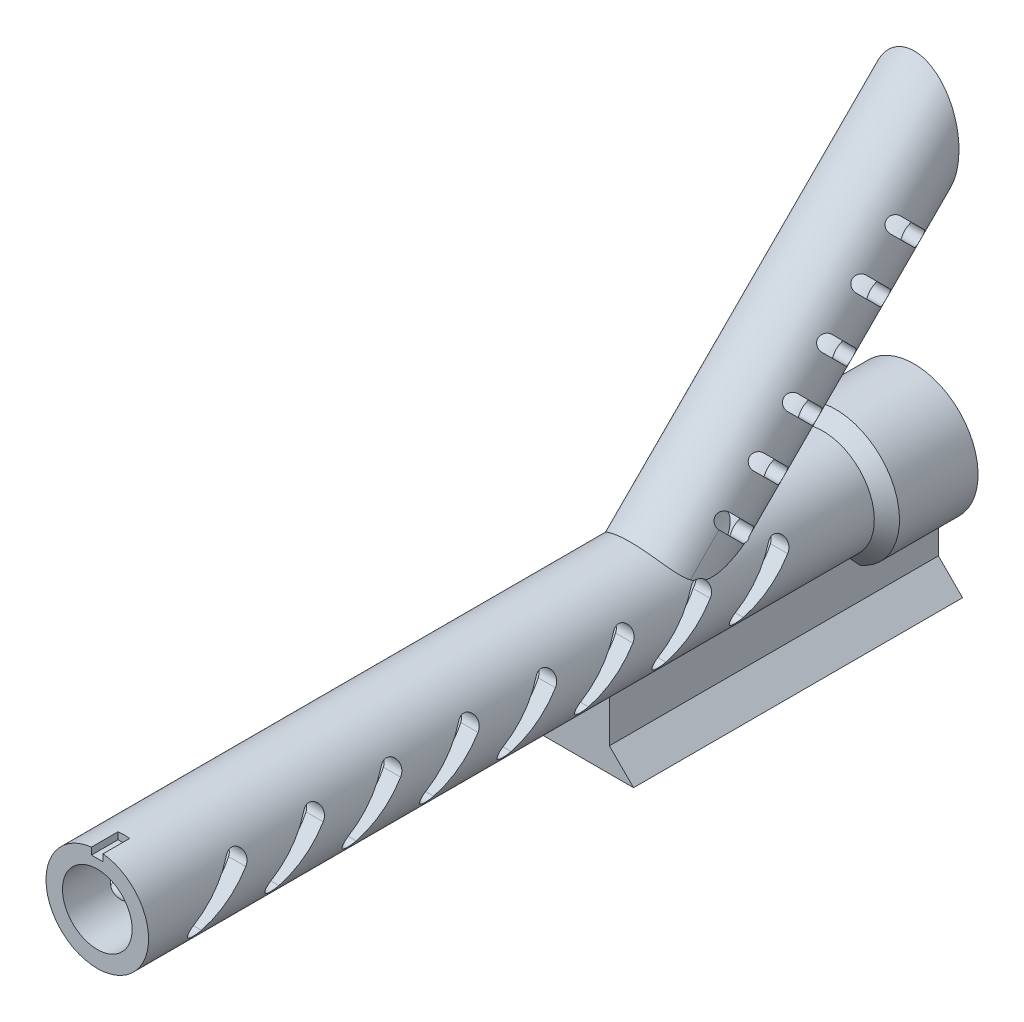
from build123d import *

# Parameters (mm, degrees)
BOSS_EXTRU_2_REACH                  = 163.916
BOSS_EXTRU_2_END_RADIUS             = 10.6
ESQUISSE12_R                        = 9.25
BOSS_EXTRU_2_DIRECTION_2_REACH      = 163.916
ENL_V_MAT_EXTRU_4_REACH             = 173.321
ENL_V_MAT_EXTRU_4_END_RADIUS        = 7.2
ESQUISSE16_R                        = 6.75
ENL_V_MAT_EXTRU_4_DIRECTION_2_REACH = 173.321
ENL_V_MAT_EXTRU_1_DEPTH             = 167.492403835
R_P_TITION_LIN_AIRE1_COUNT          = 8
R_P_TITION_LIN_AIRE1_PITCH          = 16
ESQUISSE5_W                         = 2.4
ESQUISSE5_H                         = 1.5
ENL_V_MAT_EXTRU_2_DEPTH             = 5.5
ENL_V_MAT_EXTRU_3_DEPTH             = 167.492403835
R_P_TITION_LIN_AIRE2_COUNT          = 6
R_P_TITION_LIN_AIRE2_PITCH          = 10
BOSS_EXTRU_3_DEPTH                  = 50
BOSS_EXTRU_3_DIRECTION_2_REACH      = 168.492
ESQUISSE17_W                        = 5.4
ESQUISSE17_H                        = 3.4
ENL_V_MAT_EXTRU_5_DEPTH             = 5


with BuildPart() as part:
    # Esquisse3 → Révolution2 (revolve)
    with BuildSketch(Plane(origin=(0, 0, 0), x_dir=(0, 0, -1), z_dir=(1, 0, 0)), mode=Mode.PRIVATE) as r_volution2_sk:
        Polygon((-0.842640687, 10.6), (-150.842640687, 10.6), (-150.842640687, 7.2), (0, 7.2), (3, 10.2), (18, 10.2), (18, 13.2), (1.757359313, 13.2), align=None)
    revolve(r_volution2_sk.sketch.rotate(Axis((0, 0, 115.245192858), (0, 0, -1)), 90), axis=Axis((0, 0, 115.245192858), (0, 0, -1)))

    # Boss.-Extru.2: up to this cylinder (the profile starts outside it)
    boss_extru_2_end = Plane(origin=(0, 0, 10.07132), z_dir=(0, 0, 1)) * Cylinder(BOSS_EXTRU_2_END_RADIUS, 350.032, mode=Mode.PRIVATE)
    # Esquisse12 → Boss.-Extru.2 (add, up to the surface)
    with BuildSketch(Plane(origin=(0, 9, -9), x_dir=(-1, 0, 0), z_dir=(0, 0.7071067811865475, -0.7071067811865477)), mode=Mode.PRIVATE) as boss_extru_2_sk1:
        with Locations(Location((0, 26.970919882, 0), (0, 0, 90))):
            Circle(ESQUISSE12_R)
    boss_extru_2_tool1 = extrude(boss_extru_2_sk1.sketch, amount=-BOSS_EXTRU_2_REACH, mode=Mode.PRIVATE) - boss_extru_2_end
    add(boss_extru_2_tool1.solids().sort_by_distance((0, 28.07132, 10.07132))[0])

    # Boss.-Extru.2 direction 2: up to this plane
    boss_extru_2_direction_2_end = Plane(origin=(0, 13.2, -18), z_dir=(0, 0, 1))
    # Esquisse12 → Boss.-Extru.2 direction 2 (add, up to the surface)
    with BuildSketch(Plane(origin=(0, 9, -9), x_dir=(-1, 0, 0), z_dir=(0, 0.7071067811865475, -0.7071067811865477)), mode=Mode.PRIVATE) as boss_extru_2_direction_2_sk1:
        with Locations(Location((0, 26.970919882, 0), (0, 0, 90))):
            Circle(ESQUISSE12_R)
    boss_extru_2_direction_2_tool1 = split(extrude(boss_extru_2_direction_2_sk1.sketch, amount=BOSS_EXTRU_2_DIRECTION_2_REACH, mode=Mode.PRIVATE), bisect_by=boss_extru_2_direction_2_end, keep=Keep.BOTH, mode=Mode.PRIVATE)
    add(boss_extru_2_direction_2_tool1.solids().sort_by_distance((0, 28.07132, 10.07132))[0])

    # Enlèv. mat.-Extru.4: up to this cylinder (the profile starts outside it)
    enl_v_mat_extru_4_end = Plane(origin=(0, 0, 10.07132), z_dir=(0, 0, 1)) * Cylinder(ENL_V_MAT_EXTRU_4_END_RADIUS, 362.042, mode=Mode.PRIVATE)
    # Esquisse16 → Enlèv. mat.-Extru.4 (cut, up to the surface)
    with BuildSketch(Plane(origin=(0, 9, -9), x_dir=(-1, 0, 0), z_dir=(0, 0.7071067811865475, -0.7071067811865477)), mode=Mode.PRIVATE) as enl_v_mat_extru_4_sk1:
        with Locations(Location((0, 26.970919882, 0), (0, 0, 270))):
            Circle(ESQUISSE16_R)
    enl_v_mat_extru_4_tool1 = extrude(enl_v_mat_extru_4_sk1.sketch, amount=-ENL_V_MAT_EXTRU_4_REACH, mode=Mode.PRIVATE) - enl_v_mat_extru_4_end
    add(enl_v_mat_extru_4_tool1.solids().sort_by_distance((0, 28.07132, 10.07132))[0], mode=Mode.SUBTRACT)

    # Enlèv. mat.-Extru.4 direction 2: up to this plane
    enl_v_mat_extru_4_direction_2_end = Plane(origin=(0, 13.2, -18), z_dir=(0, 0, 1))
    # Esquisse16 → Enlèv. mat.-Extru.4 direction 2 (cut, up to the surface)
    with BuildSketch(Plane(origin=(0, 9, -9), x_dir=(-1, 0, 0), z_dir=(0, 0.7071067811865475, -0.7071067811865477)), mode=Mode.PRIVATE) as enl_v_mat_extru_4_direction_2_sk1:
        with Locations(Location((0, 26.970919882, 0), (0, 0, 270))):
            Circle(ESQUISSE16_R)
    enl_v_mat_extru_4_direction_2_tool1 = split(extrude(enl_v_mat_extru_4_direction_2_sk1.sketch, amount=ENL_V_MAT_EXTRU_4_DIRECTION_2_REACH, mode=Mode.PRIVATE), bisect_by=enl_v_mat_extru_4_direction_2_end, keep=Keep.BOTH, mode=Mode.PRIVATE)
    add(enl_v_mat_extru_4_direction_2_tool1.solids().sort_by_distance((0, 28.07132, 10.07132))[0], mode=Mode.SUBTRACT)

    # Esquisse4 → Enlèv. mat.-Extru.1 (cut, symmetric)
    with BuildSketch(Plane(origin=(0, 0, 0), x_dir=(0, 0, -1), z_dir=(1, 0, 0))):
        with BuildLine():
            Line((-141.256854249, -2.585786438), (-133.256854249, 5.414213562))
            ThreePointArc((-133.256854249, 5.414213562), (-130.428427125, 5.414213562), (-130.428427125, 2.585786438))
            Line((-130.428427125, 2.585786438), (-138.428427125, -5.414213562))
            ThreePointArc((-138.428427125, -5.414213562), (-141.256854249, -5.414213562), (-141.256854249, -2.585786438))
        make_face()
    enl_v_mat_extru_1 = extrude(amount=ENL_V_MAT_EXTRU_1_DEPTH, both=True, mode=Mode.SUBTRACT)

    # Répétition linéaire1: Enlèv. mat.-Extru.1 ×8
    with Locations(*[(0, 0, -i * R_P_TITION_LIN_AIRE1_PITCH) for i in range(1, R_P_TITION_LIN_AIRE1_COUNT)]):
        add(enl_v_mat_extru_1, mode=Mode.SUBTRACT)

    # Esquisse5 → Enlèv. mat.-Extru.2 (cut)
    with BuildSketch(Plane.XY.offset(150.842640687)):
        with Locations((0, 9.85)):
            Rectangle(ESQUISSE5_W, ESQUISSE5_H)
    extrude(amount=-ENL_V_MAT_EXTRU_2_DEPTH, mode=Mode.SUBTRACT)

    # Esquisse13 → Enlèv. mat.-Extru.3 (cut, symmetric)
    with BuildSketch(Plane(origin=(0, 0, 0), x_dir=(0, 0, -1), z_dir=(1, 0, 0))):
        with BuildLine():
            Line((9.414213562, 42.607106781), (4.464466094, 47.556854249))
            ThreePointArc((4.464466094, 47.556854249), (4.464466094, 49.678174593), (6.585786438, 49.678174593))
            Line((6.585786438, 49.678174593), (11.535533906, 44.728427125))
            ThreePointArc((11.535533906, 44.728427125), (11.535533906, 42.607106781), (9.414213562, 42.607106781))
        make_face()
    enl_v_mat_extru_3 = extrude(amount=ENL_V_MAT_EXTRU_3_DEPTH, both=True, mode=Mode.SUBTRACT)

    # Répétition linéaire2: Enlèv. mat.-Extru.3 ×6
    with Locations(*[Vector(0, -0.7071067811865489, 0.7071067811865461) * (i * R_P_TITION_LIN_AIRE2_PITCH) for i in range(1, R_P_TITION_LIN_AIRE2_COUNT)]):
        add(enl_v_mat_extru_3, mode=Mode.SUBTRACT)

    # Esquisse14 → Boss.-Extru.3 (add)
    with BuildSketch(Plane(origin=(0, 0, 0), x_dir=(-1, 0, 0), z_dir=(0, 0, -1))):
        with BuildLine():
            Line((-5, -18.660254038), (-10, -23.660254038))
            Line((-10, -23.660254038), (10, -23.660254038))
            Line((10, -23.660254038), (5, -18.660254038))
            Line((5, -18.660254038), (5, -9.346657156))
            ThreePointArc((5, -9.346657156), (0, -10.6), (-5, -9.346657156))
            Line((-5, -9.346657156), (-5, -18.660254038))
        make_face()
    extrude(amount=-BOSS_EXTRU_3_DEPTH)

    # Boss.-Extru.3 direction 2: up to this face of the body (flat: up to its plane)
    boss_extru_3_direction_2_end = Plane(part.part.faces().sort_by_distance((-10.57335238, 0, -18))[0])
    # Esquisse14 → Boss.-Extru.3 direction 2 (add, up to the picked face)
    with BuildSketch(Plane(origin=(0, 0, 0), x_dir=(-1, 0, 0), z_dir=(0, 0, -1)), mode=Mode.PRIVATE) as boss_extru_3_direction_2_sk1:
        with BuildLine():
            Line((-5, -18.660254038), (-10, -23.660254038))
            Line((-10, -23.660254038), (10, -23.660254038))
            Line((10, -23.660254038), (5, -18.660254038))
            Line((5, -18.660254038), (5, -9.346657156))
            ThreePointArc((5, -9.346657156), (0, -10.6), (-5, -9.346657156))
            Line((-5, -9.346657156), (-5, -18.660254038))
        make_face()
    boss_extru_3_direction_2_tool1 = split(extrude(boss_extru_3_direction_2_sk1.sketch, amount=BOSS_EXTRU_3_DIRECTION_2_REACH, mode=Mode.PRIVATE), bisect_by=boss_extru_3_direction_2_end, keep=Keep.BOTH, mode=Mode.PRIVATE)
    add(boss_extru_3_direction_2_tool1.solids().sort_by(Axis((0, -17.715497, 0), (0, 0, -1)))[0])

    # Esquisse17 → Enlèv. mat.-Extru.5 (cut)
    with BuildSketch(Plane(origin=(0, -23.660254038, 0), x_dir=(-1, 0, 0), z_dir=(0, -1, 0))):
        with Locations((0, 2.8)):
            Rectangle(ESQUISSE17_W, ESQUISSE17_H)
    extrude(amount=-ENL_V_MAT_EXTRU_5_DEPTH, mode=Mode.SUBTRACT)


solid = part.part
